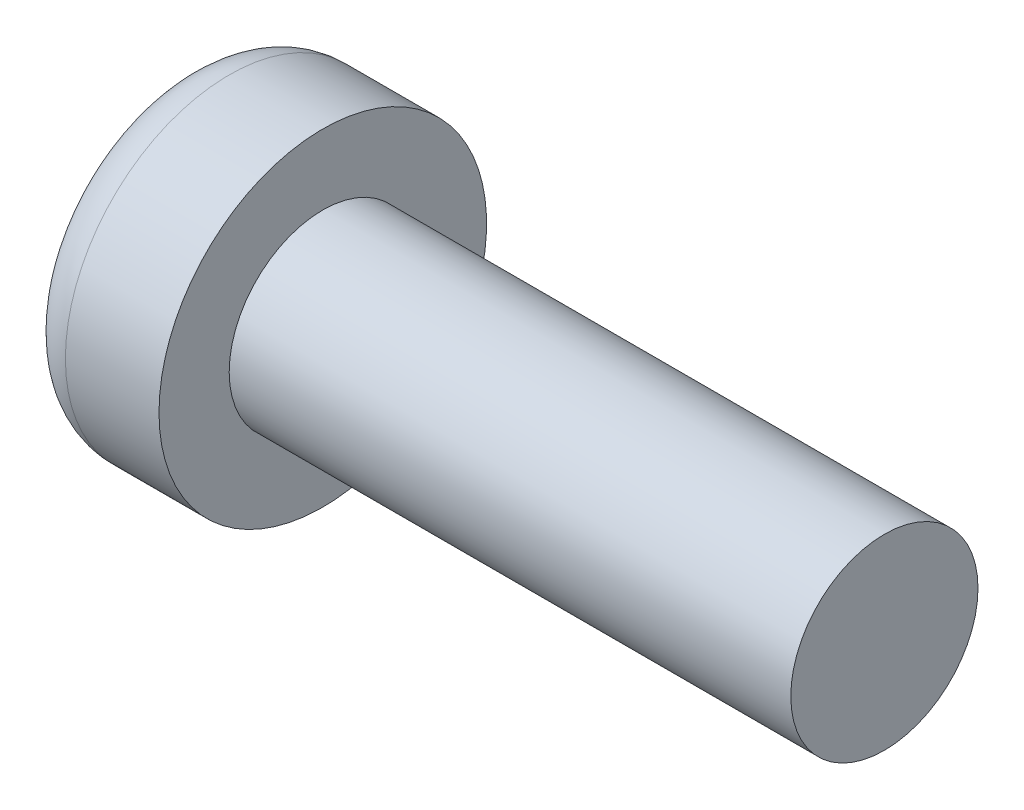
from build123d import *


with BuildPart() as part:
    # Sketch1 → Revolve1 (revolve)
    with BuildSketch(Plane.XY, mode=Mode.PRIVATE) as revolve1_sk:
        with BuildLine():
            Line((0, 0), (0.985220193, 0))
            Line((0.985220193, 0), (7.5, 0))
            Line((7.5, 0), (7.5, 1))
            Line((7.5, 1), (1.5, 1))
            Line((1.5, 1), (1.5, 1.75))
            Line((1.5, 1.75), (0.5, 1.75))
            ThreePointArc((0.5, 1.75), (0.146446609, 1.603553391), (0, 1.25))
            Line((0, 1.25), (0, 0))
        make_face()
    revolve(revolve1_sk.sketch.rotate(Axis((0, 0, 0), (1, 0, 0)), 90), axis=Axis((0, 0, 0), (1, 0, 0)))


solid = part.part
